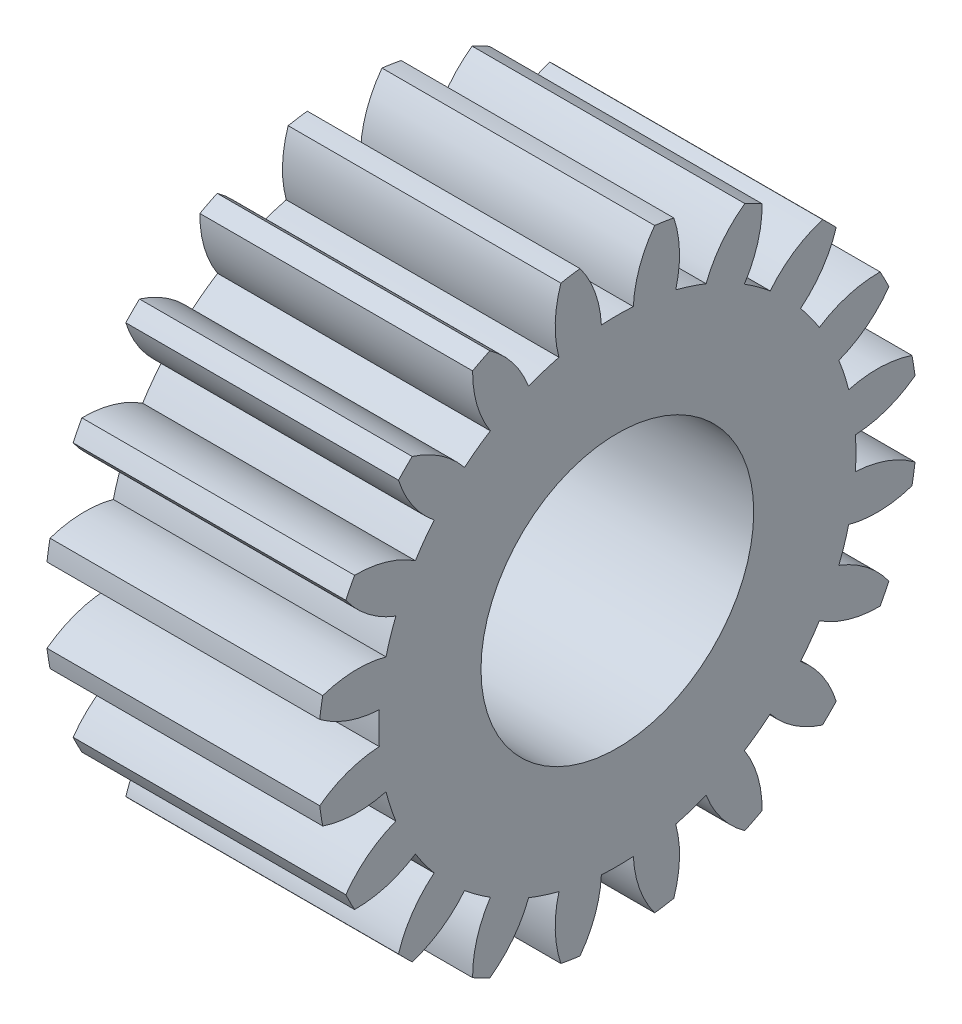
from build123d import *

# Parameters (mm, degrees)
BASPROSKE_W     = 15
BASPROSKE_H     = 16.5
TOOTHCUT_DEPTH  = 28.739863013
TEETHCUTS_COUNT = 20
TEETHCUTS_ANGLE = 342
BORSKE_R        = 7.5
BORE_DEPTH      = 50.0000508


with BuildPart() as part:
    # BasProSke → Base-Revolve (revolve)
    with BuildSketch(Plane(origin=(0, 0, 0), x_dir=(1, 0, 0), z_dir=(0, 1, 0)), mode=Mode.PRIVATE) as base_revolve_sk:
        with Locations((7.5, 8.25)):
            Rectangle(BASPROSKE_W, BASPROSKE_H)
    revolve(base_revolve_sk.sketch.rotate(Axis((-10, 0, 0), (1, 0, 0)), 180), axis=Axis((-10, 0, 0), (1, 0, 0)))

    # TooCutSke → ToothCut (cut, through all)
    with BuildSketch(Plane(origin=(0, 0, 0), x_dir=(0, 0, -1), z_dir=(1, 0, 0))):
        with BuildLine():
            ThreePointArc((0.877929023, 13.094602576), (0, 13.124), (-0.877929023, 13.094602576))
            ThreePointArc((-0.877929023, 13.094602576), (-1.227785764, 14.834041313), (-2.071065599, 16.395106966))
            ThreePointArc((-2.071065599, 16.395106966), (0, 16.5254), (2.071065599, 16.395106966))
            ThreePointArc((2.071065599, 16.395106966), (1.227785764, 14.834041313), (0.877929023, 13.094602576))
        make_face()
    toothcut = extrude(amount=TOOTHCUT_DEPTH, mode=Mode.SUBTRACT)

    # TeethCuts: ToothCut ×20 about axis
    teethcuts_axis = Axis((-10, 0, 0), (1, 0, 0))
    for i in range(1, TEETHCUTS_COUNT):
        add(toothcut.rotate(teethcuts_axis, i * TEETHCUTS_ANGLE / (TEETHCUTS_COUNT - 1)), mode=Mode.SUBTRACT)

    # BorSke → Bore (cut, symmetric)
    with BuildSketch(Plane(origin=(0, 0, 0), x_dir=(0, 0, -1), z_dir=(1, 0, 0))):
        with Locations(Location((0, 0, 0), (0, 0, 180))):
            Circle(BORSKE_R)
    extrude(amount=BORE_DEPTH, both=True, mode=Mode.SUBTRACT)


solid = part.part
